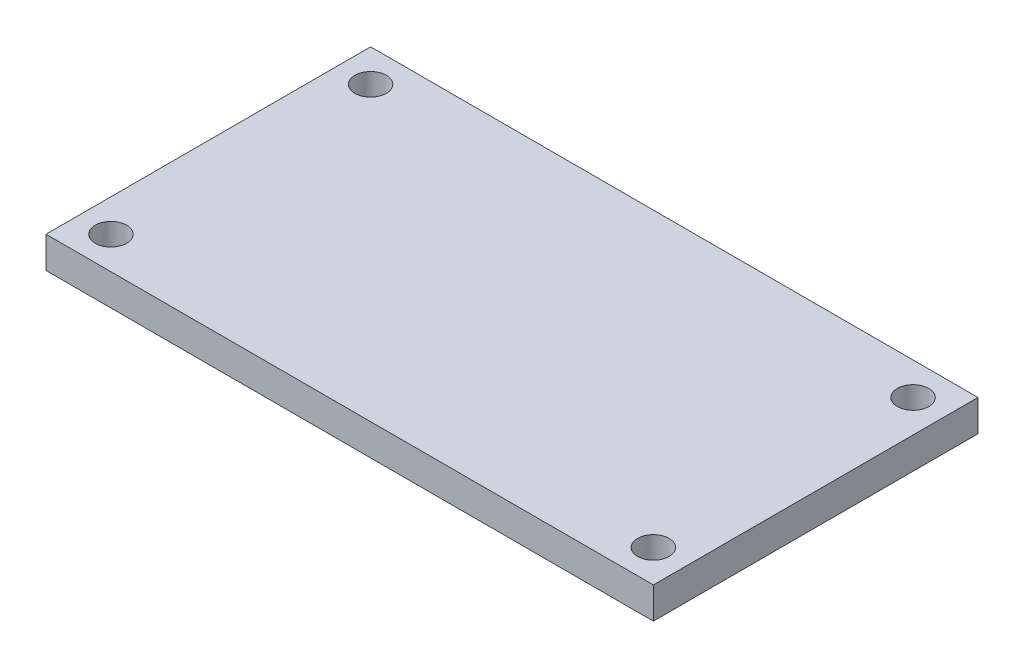
from build123d import *

# Parameters (mm, degrees)
SKETCH1_W               = 58
SKETCH1_H               = 31
BOSS_EXTRUDE1_DEPTH     = 3
SKETCH2_R               = 1.5
CUT_EXTRUDE1_DEPTH      = 34.018933962
MIRROR2_COPY_1_SKETCH_R = 1.5
MIRROR2_COPY_1_DEPTH    = 34.018933962


with BuildPart() as part:
    # Sketch1 → Boss-Extrude1 (new body)
    with BuildSketch(Plane(origin=(0, 0, 0), x_dir=(1, 0, 0), z_dir=(0, 1, 0))):
        Rectangle(SKETCH1_W, SKETCH1_H)
    extrude(amount=BOSS_EXTRUDE1_DEPTH)

    # Sketch2 → Cut-Extrude1 (cut, through all)
    with BuildSketch(Plane(origin=(0, 3, 0), x_dir=(1, 0, 0), z_dir=(0, 1, 0))):
        with Locations(Location((-25.9, 12.4, 0), (0, 0, 270))):
            Circle(SKETCH2_R)
    cut_extrude1 = extrude(amount=-CUT_EXTRUDE1_DEPTH, mode=Mode.SUBTRACT)

    # Mirror1: Cut-Extrude1 across plane
    add(cut_extrude1.mirror(Plane.XY), mode=Mode.SUBTRACT)

    # Mirror2: Cut-Extrude1 across plane
    add(cut_extrude1.mirror(Plane(origin=(0, 0, 0), x_dir=(0, 0, 1), z_dir=(1, 0, 0))), mode=Mode.SUBTRACT)

    # Mirror2 copy 1 sketch → Mirror2 copy 1 (cut, through all)
    with BuildSketch(Plane(origin=(0, 3, 0), x_dir=(-1, 0, 0), z_dir=(0, 1, 0))):
        with Locations(Location((-25.9, 12.4, 0), (0, 0, 270))):
            Circle(MIRROR2_COPY_1_SKETCH_R)
    extrude(amount=-MIRROR2_COPY_1_DEPTH, mode=Mode.SUBTRACT)


solid = part.part
